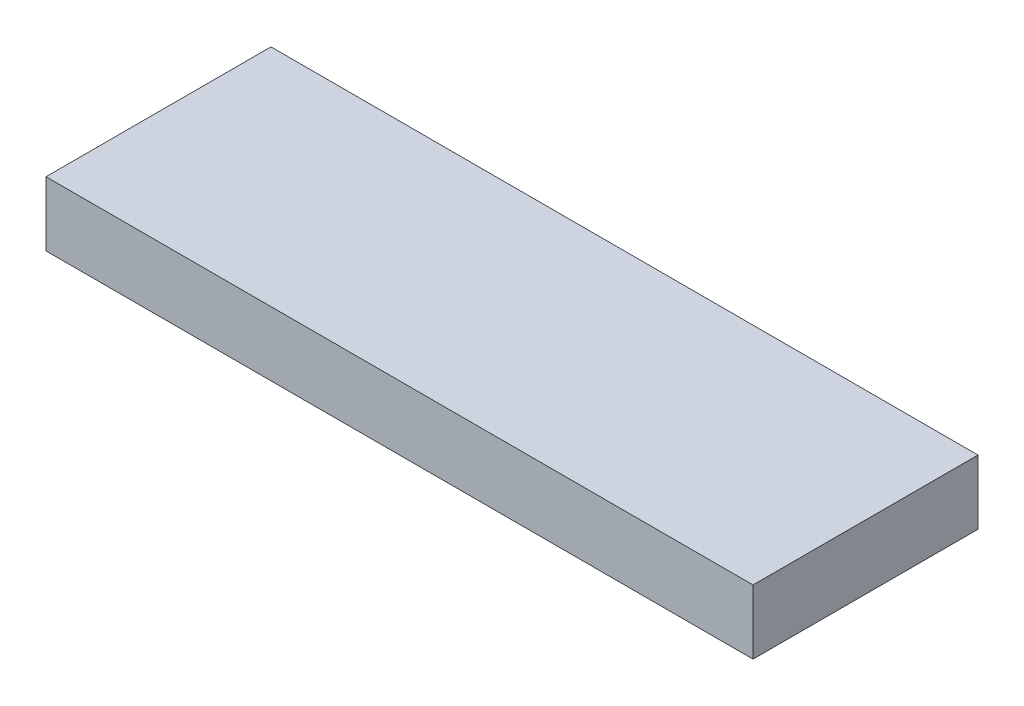
from build123d import *

# Parameters (mm, degrees)
SKETCH1_W           = 22
SKETCH1_H           = 2
BOSS_EXTRUDE1_DEPTH = 7


with BuildPart() as part:
    # Sketch1 → Boss-Extrude1 (new body)
    with BuildSketch(Plane.XY):
        with Locations((11, 1)):
            Rectangle(SKETCH1_W, SKETCH1_H)
    extrude(amount=BOSS_EXTRUDE1_DEPTH)


solid = part.part
